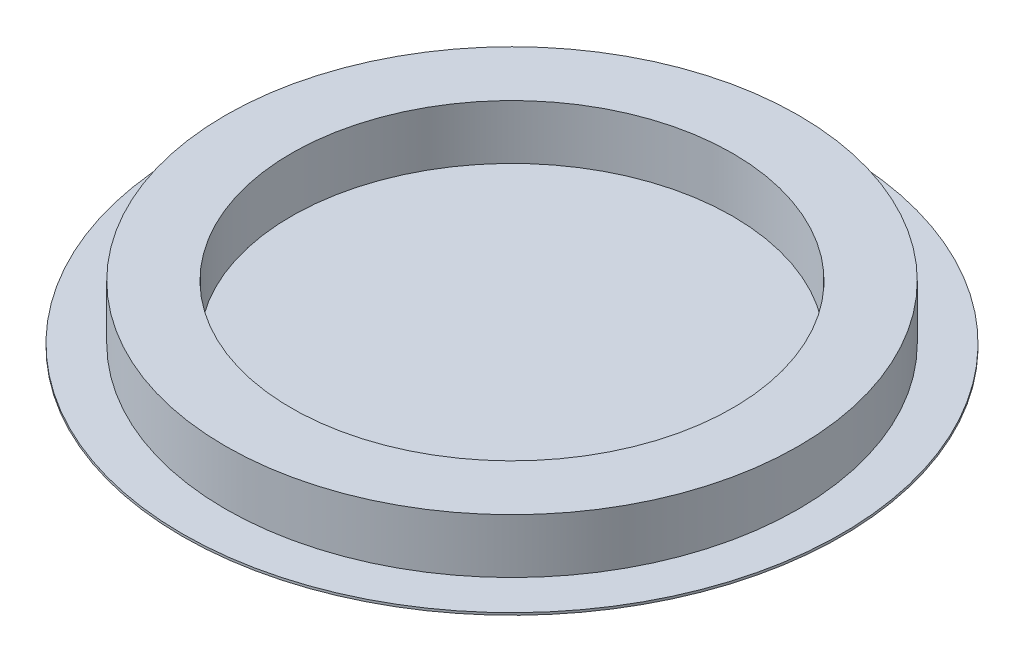
from build123d import *

# Parameters (mm, degrees)
SKETCH1_R           = 11.5
BOSS_EXTRUDE1_DEPTH = 0.08
SKETCH2_R           = 10
SKETCH2_R_2         = 7.7
BOSS_EXTRUDE2_DEPTH = 1.9


with BuildPart() as part:
    # Sketch1 → Boss-Extrude1 (new body)
    with BuildSketch(Plane(origin=(0, 0, 0), x_dir=(1, 0, 0), z_dir=(0, 1, 0))):
        with Locations(Location((0, 0, 0), (0, 0, 90))):
            Circle(SKETCH1_R)
    extrude(amount=BOSS_EXTRUDE1_DEPTH)

    # Sketch2 → Boss-Extrude2 (add)
    with BuildSketch(Plane(origin=(0, 0.08, 0), x_dir=(1, 0, 0), z_dir=(0, 1, 0))):
        with Locations(Location((0, 0, 0), (0, 0, 90))):
            Circle(SKETCH2_R)
        with Locations(Location((0, 0, 0), (0, 0, 90))):
            Circle(SKETCH2_R_2, mode=Mode.SUBTRACT)
    extrude(amount=BOSS_EXTRUDE2_DEPTH)


solid = part.part
